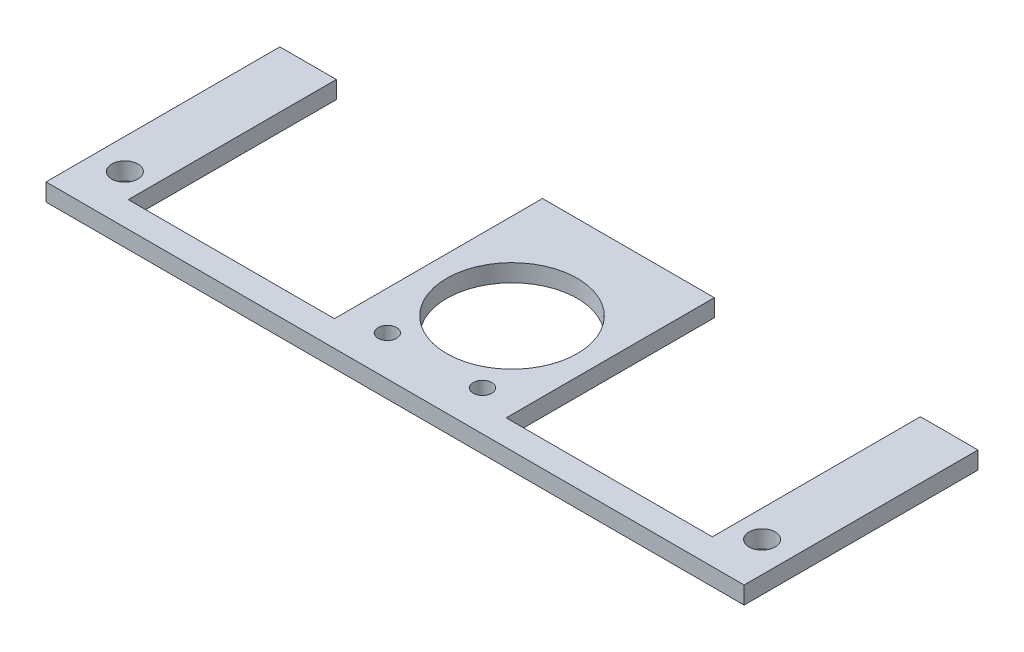
from build123d import *

# Parameters (mm, degrees)
SKETCH1_W                 = 101.6
SKETCH1_H                 = 34.036
BOSS_EXTRUDE1_DEPTH       = 2.54
CUT_EXTRUDE2_DEPTH        = 2.54
LPATTERN1_COUNT           = 2
LPATTERN1_PITCH           = 55
TAP_DRILL_FOR_6_32_TAP1_D = 2.7051
SKETCH2_R                 = 9.5
CUT_EXTRUDE3_DEPTH        = 2.54
SKETCH11_R                = 1.905
CUT_EXTRUDE5_DEPTH        = 2.54


with BuildPart() as part:
    # Sketch1 → Boss-Extrude1 (new body)
    with BuildSketch(Plane(origin=(0, 0, 0), x_dir=(1, 0, 0), z_dir=(0, 1, 0))):
        with Locations((50.8, 17.018)):
            Rectangle(SKETCH1_W, SKETCH1_H)
    extrude(amount=BOSS_EXTRUDE1_DEPTH)

    # Sketch7 → Cut-Extrude2 (cut)
    with BuildSketch(Plane(origin=(0, 2.54, 0), x_dir=(1, 0, 0), z_dir=(0, 1, 0))):
        Polygon((38.220191954, 3.75), (38.220191954, 18.75), (38.220191954, 34.036), (8.22019201, 34.036), (8.22019201, 3.75), align=None)
    cut_extrude2 = extrude(amount=-CUT_EXTRUDE2_DEPTH, mode=Mode.SUBTRACT)

    # LPattern1: Cut-Extrude2 ×2
    with Locations(*[(i * LPATTERN1_PITCH, 0, 0) for i in range(1, LPATTERN1_COUNT)]):
        add(cut_extrude2, mode=Mode.SUBTRACT)

    # Tap Drill for #6-32 Tap1 (through all)
    with Locations(Plane(origin=(0, 2.54, 0), x_dir=(1, 0, 0), z_dir=(0, 1, 0))):
        with Locations((43.875, 5.800000084), (57.725, 5.8)):
            Hole(TAP_DRILL_FOR_6_32_TAP1_D / 2)

    # Sketch2 → Cut-Extrude3 (cut)
    with BuildSketch(Plane(origin=(0, 2.54, 0), x_dir=(1, 0, 0), z_dir=(0, 1, 0))):
        with Locations(Location((50.8, 17.018, 0), (0, 0, 270))):
            Circle(SKETCH2_R)
    extrude(amount=-CUT_EXTRUDE3_DEPTH, mode=Mode.SUBTRACT)

    # Sketch11 → Cut-Extrude5 (cut)
    with BuildSketch(Plane(origin=(0, 2.54, 0), x_dir=(1, 0, 0), z_dir=(0, 1, 0))):
        with Locations(Location((4.43, 7.045, 0), (0, 0, 270))):
            Circle(SKETCH11_R)
        with Locations(Location((97.17, 7.045, 0), (0, 0, 270))):
            Circle(SKETCH11_R)
    extrude(amount=-CUT_EXTRUDE5_DEPTH, mode=Mode.SUBTRACT)


solid = part.part
